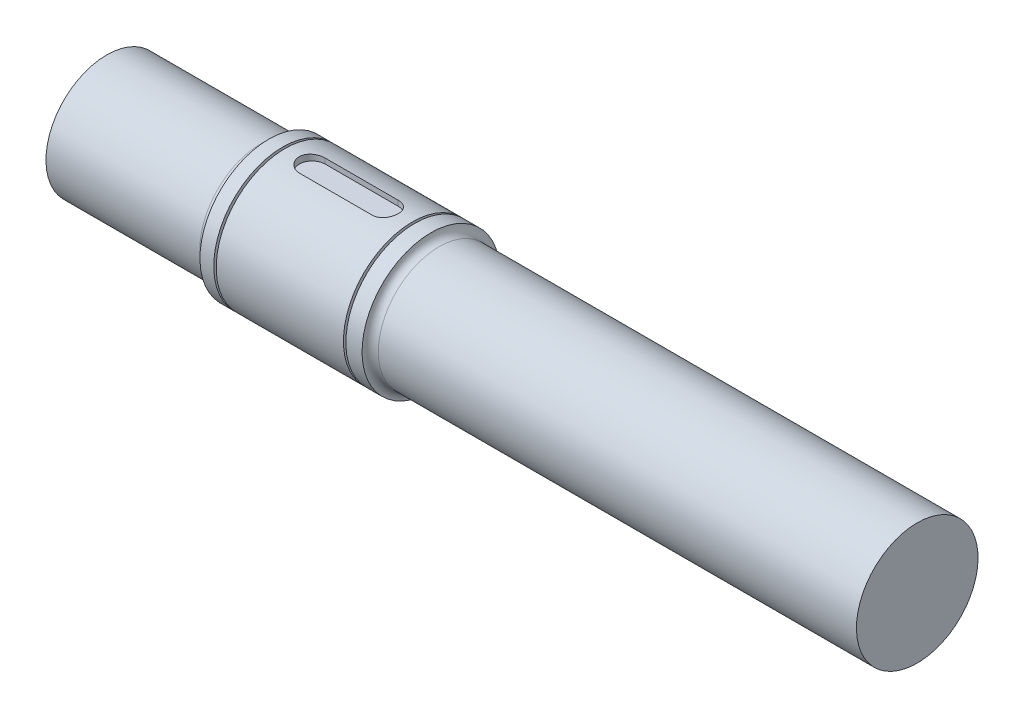
from build123d import *

# Parameters (mm, degrees)
ESQUISSE2_R             = 42.5
ESQUISSE2_R_2           = 39.5
ENL_V_MAT_EXTRU_1_DEPTH = 1.5
ESQUISSE3_R             = 42.5
ESQUISSE3_R_2           = 39.5
ENL_V_MAT_EXTRU_2_DEPTH = 1.5
ENL_V_MAT_EXTRU_3_DEPTH = 4


with BuildPart() as part:
    # Esquisse1 → Révolution1 (revolve)
    with BuildSketch(Plane.XY):
        with BuildLine():
            Line((0, 0), (0, 37.5))
            Line((0, 37.5), (95, 37.5))
            ThreePointArc((95, 37.5), (98.535533906, 38.964466094), (100, 42.5))
            Line((100, 42.5), (200, 42.5))
            ThreePointArc((200, 42.5), (201.464466094, 38.964466094), (205, 37.5))
            Line((205, 37.5), (500, 37.5))
            Line((500, 37.5), (500, 0))
            Line((500, 0), (0, 0))
        make_face()
    revolve(axis=Axis((500, 0, 0), (-1, 0, 0)))

    # Esquisse2 → Enlèv. mat.-Extru.1 (cut)
    with BuildSketch(Plane(origin=(110, 0, 0), x_dir=(0, 0, -1), z_dir=(1, 0, 0))):
        with Locations(Location((0, 0, 0), (0, 0, 90))):
            Circle(ESQUISSE2_R)
        Circle(ESQUISSE2_R_2, mode=Mode.SUBTRACT)
    extrude(amount=-ENL_V_MAT_EXTRU_1_DEPTH, mode=Mode.SUBTRACT)

    # Esquisse3 → Enlèv. mat.-Extru.2 (cut)
    with BuildSketch(Plane(origin=(190, 0, 0), x_dir=(0, 0, -1), z_dir=(1, 0, 0))):
        Circle(ESQUISSE3_R)
        Circle(ESQUISSE3_R_2, mode=Mode.SUBTRACT)
    extrude(amount=-ENL_V_MAT_EXTRU_2_DEPTH, mode=Mode.SUBTRACT)

    # Esquisse4 → Enlèv. mat.-Extru.3 (cut)
    with BuildSketch(Plane(origin=(0, 42.5, 0), x_dir=(1, 0, 0), z_dir=(0, 1, 0))):
        with BuildLine():
            Line((126.75, 8), (171.75, 8))
            ThreePointArc((171.75, 8), (179.75, 0), (171.75, -8))
            Line((171.75, -8), (126.75, -8))
            ThreePointArc((126.75, -8), (118.75, 0), (126.75, 8))
        make_face()
    extrude(amount=-ENL_V_MAT_EXTRU_3_DEPTH, mode=Mode.SUBTRACT)


solid = part.part
